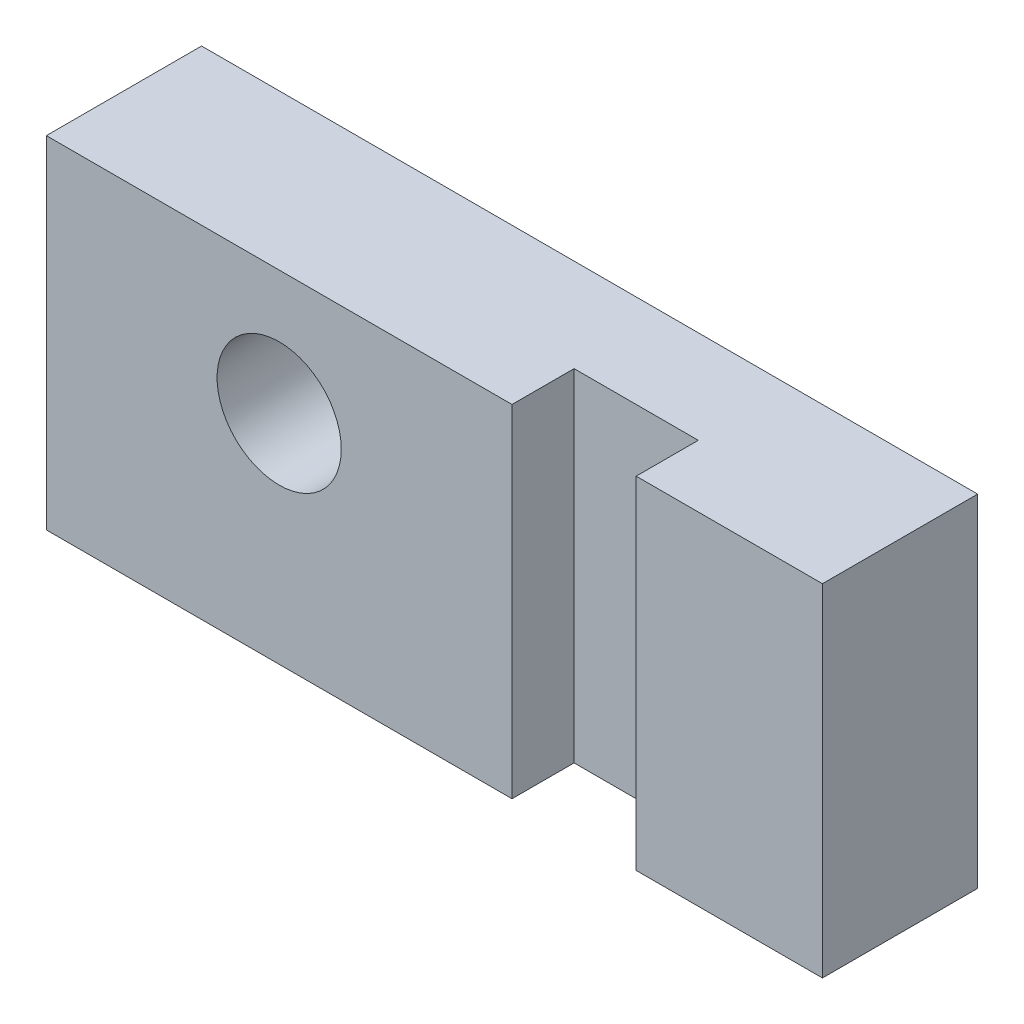
from build123d import *

# Parameters (mm, degrees)
SKETCH_1_W          = 50
SKETCH_1_H          = 22
EXTRUDE_1_DEPTH     = 10
SKETCH_2_R          = 4
CUT_EXTRUDE_1_DEPTH = 30.086079144
SKETCH_3_W          = 8
SKETCH_3_H          = 22
CUT_EXTRUDE_2_DEPTH = 4


with BuildPart() as part:
    # Эскиз1 → Бобышка-Вытянуть1 (new body)
    with BuildSketch(Plane.XY):
        Rectangle(SKETCH_1_W, SKETCH_1_H)
    extrude(amount=EXTRUDE_1_DEPTH)

    # Эскиз2 → Вырез-Вытянуть1 (cut, through all)
    with BuildSketch(Plane.XY.offset(10)):
        with Locations((-10, 3)):
            Circle(SKETCH_2_R)
    extrude(amount=-CUT_EXTRUDE_1_DEPTH, mode=Mode.SUBTRACT)

    # Эскиз3 → Вырез-Вытянуть2 (cut)
    with BuildSketch(Plane.XY.offset(10)):
        with Locations((9, 0)):
            Rectangle(SKETCH_3_W, SKETCH_3_H)
    extrude(amount=-CUT_EXTRUDE_2_DEPTH, mode=Mode.SUBTRACT)


solid = part.part
